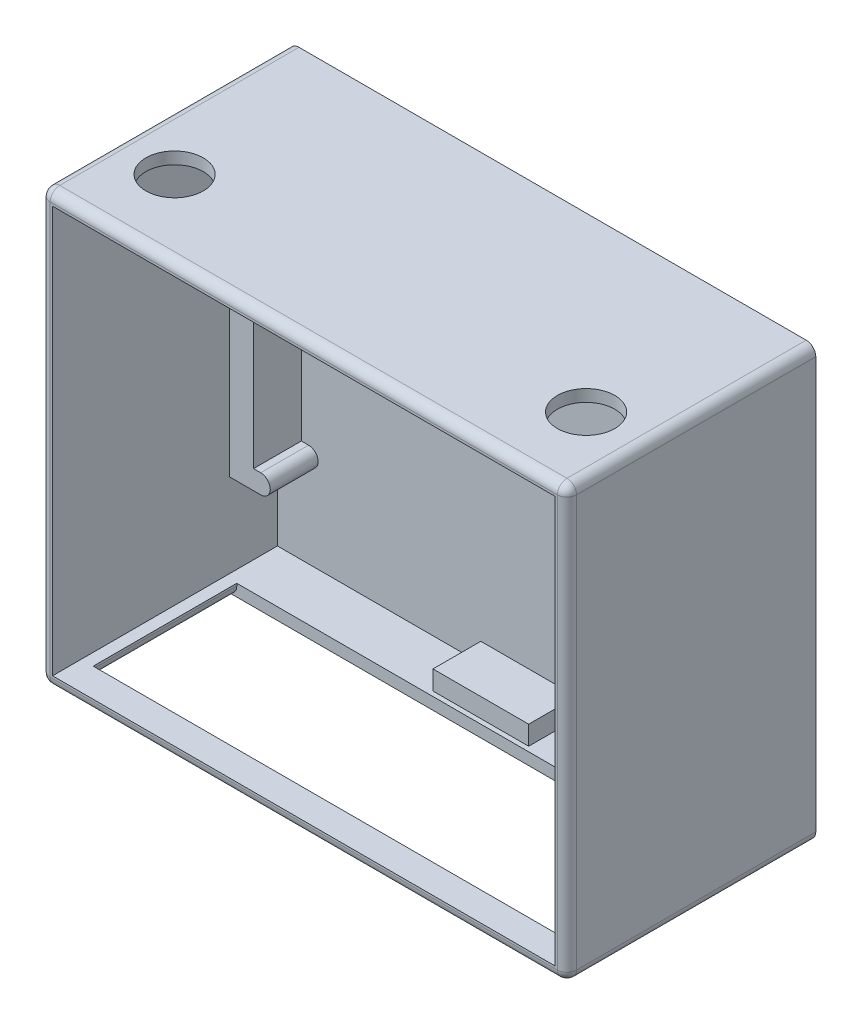
from build123d import *

# Parameters (mm, degrees)
SKETCH_1_W           = 110
SKETCH_1_H           = 90
EXTRUDE_1_DEPTH      = 60
SKETCH_2_W           = 105
SKETCH_2_H           = 85
CUT_EXTRUDE_1_DEPTH  = 55
SKETCH_3_W           = 100
SKETCH_3_H           = 30
CUT_EXTRUDE_2_DEPTH  = 12
SKETCH_4_R           = 6
CUT_EXTRUDE_3_DEPTH  = 12
EXTRUDE_2_DEPTH      = 5
EXTRUDE_2_DEPTH_BACK = 10
SKETCH_6_W           = 20
SKETCH_6_H           = 4
SKETCH_6_W_2         = 5
SKETCH_6_H_2         = 45
EXTRUDE_3_DEPTH      = 5
EXTRUDE_3_DEPTH_BACK = 10
SKETCH_10_W          = 110
SKETCH_10_H          = 8
CUT_EXTRUDE_4_DEPTH  = 122.346610995
FILLET_1_R           = 2


with BuildPart() as part:
    # 스케치1 → 보스-돌출1 (new body)
    with BuildSketch(Plane.XY):
        Rectangle(SKETCH_1_W, SKETCH_1_H)
    extrude(amount=EXTRUDE_1_DEPTH)

    # 스케치2 → 컷-돌출1 (cut)
    with BuildSketch(Plane.XY.offset(60)):
        Rectangle(SKETCH_2_W, SKETCH_2_H)
    extrude(amount=-CUT_EXTRUDE_1_DEPTH, mode=Mode.SUBTRACT)

    # 스케치3 → 컷-돌출2 (cut)
    with BuildSketch(Plane.XZ.offset(45)):
        with Locations((0, 31)):
            Rectangle(SKETCH_3_W, SKETCH_3_H)
    extrude(amount=-CUT_EXTRUDE_2_DEPTH, mode=Mode.SUBTRACT)

    # 스케치4 → 컷-돌출3 (cut)
    with BuildSketch(Plane(origin=(0, 45, 0), x_dir=(1, 0, 0), z_dir=(0, 1, 0))):
        with Locations(Location((-43, -36, 0), (0, 0, 270))):
            Circle(SKETCH_4_R)
        with Locations(Location((43, -36, 0), (0, 0, 270))):
            Circle(SKETCH_4_R)
    extrude(amount=-CUT_EXTRUDE_3_DEPTH, mode=Mode.SUBTRACT)

    # 스케치6 → 보스-돌출2 (add, two sides: drawn at the far end of the back side and taken through both)
    with BuildSketch(Plane.XY.offset(10).offset(-EXTRUDE_2_DEPTH_BACK)):
        with Locations((0, 40.5)):
            Rectangle(SKETCH_6_W, SKETCH_6_H)
        with Locations((50, 0)):
            Rectangle(SKETCH_6_W_2, SKETCH_6_H_2)
        with Locations((0, -40.5)):
            Rectangle(SKETCH_6_W, SKETCH_6_H)
        with Locations((-50, 0)):
            Rectangle(SKETCH_6_W_2, SKETCH_6_H_2)
    extrude(amount=EXTRUDE_2_DEPTH + EXTRUDE_2_DEPTH_BACK)

    # 스케치7 → 보스-돌출3 (add, two sides: drawn at the far end of the back side and taken through both)
    with BuildSketch(Plane.XY.offset(10).offset(-EXTRUDE_3_DEPTH_BACK)):
        with BuildLine():
            Line((-46, -21), (-50, -21))
            Line((-50, -21), (-47.5, -22.5))
            Line((-47.5, -22.5), (-52.5, -22.5))
            Line((-52.5, -22.5), (-52.5, -25))
            Line((-52.5, -25), (-46, -25))
            ThreePointArc((-46, -25), (-44, -23), (-46, -21))
        make_face()
        with BuildLine():
            Line((-34.5, 38), (-34.5, 42.5))
            Line((-34.5, 42.5), (-37.5, 42.5))
            Line((-37.5, 42.5), (-37.5, 38))
            ThreePointArc((-37.5, 38), (-36, 36.5), (-34.5, 38))
        make_face()
        with BuildLine():
            Line((42, -24), (50, -24))
            Line((50, -24), (47.5, -22.5))
            Line((47.5, -22.5), (52.5, -22.5))
            Line((52.5, -22.5), (52.5, -28))
            Line((52.5, -28), (42, -28))
            ThreePointArc((42, -28), (40, -26), (42, -24))
        make_face()
        with BuildLine():
            Line((44.5, 36), (44.5, 42.5))
            Line((44.5, 42.5), (52.5, 42.5))
            Line((52.5, 42.5), (52.5, 28))
            Line((52.5, 28), (44.5, 28))
            ThreePointArc((44.5, 28), (40.5, 32), (44.5, 36))
        make_face()
    extrude(amount=EXTRUDE_3_DEPTH + EXTRUDE_3_DEPTH_BACK)

    # 스케치10 → 컷-돌출4 (cut, through all)
    with BuildSketch(Plane.XZ.offset(45)):
        with Locations((0, 56)):
            Rectangle(SKETCH_10_W, SKETCH_10_H)
    extrude(amount=-CUT_EXTRUDE_4_DEPTH, mode=Mode.SUBTRACT)

    # 필렛1
    fillet_1_edges = [part.edges().sort_by_distance(p)[0] for p in [
        (55, -45, 26),
        (-55, -45, 26),
        (-55, 45, 26),
        (55, 45, 26),
        (0, 45, 52),
        (55, 0, 52),
        (-55, 0, 52),
        (0, -45, 52),
        (50, -45, 31),
        (0, -45, 46),
        (-50, -45, 31),
    ]]
    fillet(fillet_1_edges, radius=FILLET_1_R)


solid = part.part
